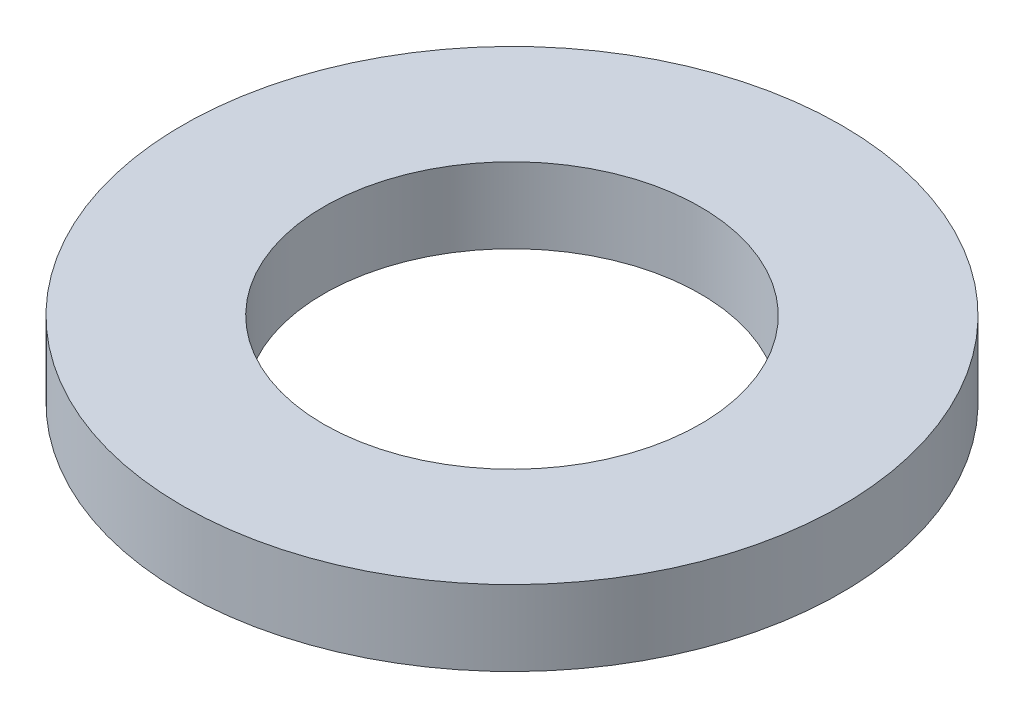
from build123d import *

# Parameters (mm, degrees)
SKETCH_1_R      = 17.5
SKETCH_1_R_2    = 10
EXTRUDE_1_DEPTH = 4


with BuildPart() as part:
    # 草图1 → 凸台-拉伸1 (new body)
    with BuildSketch(Plane(origin=(0, 0, 0), x_dir=(1, 0, 0), z_dir=(0, 1, 0))):
        with Locations(Location((0, 0, 0), (0, 0, 270))):
            Circle(SKETCH_1_R)
        with Locations(Location((0, 0, 0), (0, 0, 270))):
            Circle(SKETCH_1_R_2, mode=Mode.SUBTRACT)
    extrude(amount=EXTRUDE_1_DEPTH)


solid = part.part
